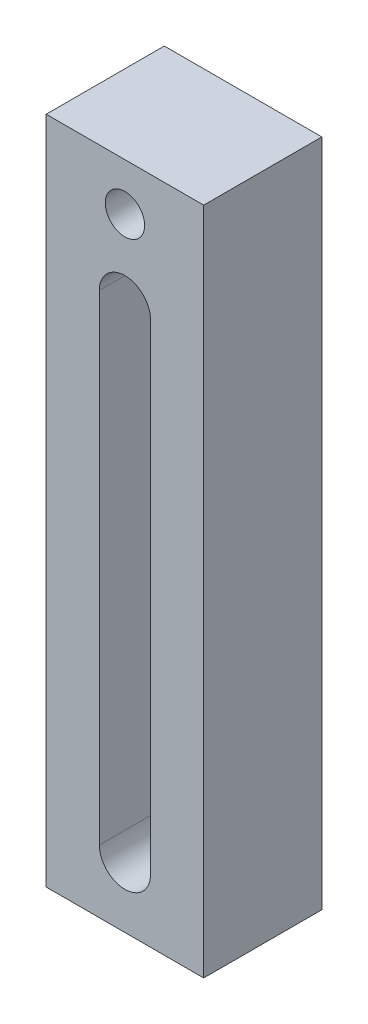
from build123d import *

# Parameters (mm, degrees)
ESQUISSE1_W             = 20
ESQUISSE1_H             = 85
BOSS_EXTRU_1_DEPTH      = 15
ESQUISSE2_R             = 2.5
ENL_V_MAT_EXTRU_1_DEPTH = 15


with BuildPart() as part:
    # Esquisse1 → Boss.-Extru.1 (new body)
    with BuildSketch(Plane.XY):
        with Locations((10, 42.5)):
            Rectangle(ESQUISSE1_W, ESQUISSE1_H)
    extrude(amount=BOSS_EXTRU_1_DEPTH)

    # Esquisse2 → Enlèv. mat.-Extru.1 (cut)
    with BuildSketch(Plane.XY.offset(15)):
        with Locations((10, 79)):
            Circle(ESQUISSE2_R)
        with BuildLine():
            Line((6.75, 8), (6.75, 69))
            ThreePointArc((6.75, 69), (10, 72.25), (13.25, 69))
            Line((13.25, 69), (13.25, 8))
            ThreePointArc((13.25, 8), (10, 4.75), (6.75, 8))
        make_face()
    extrude(amount=-ENL_V_MAT_EXTRU_1_DEPTH, mode=Mode.SUBTRACT)


solid = part.part
